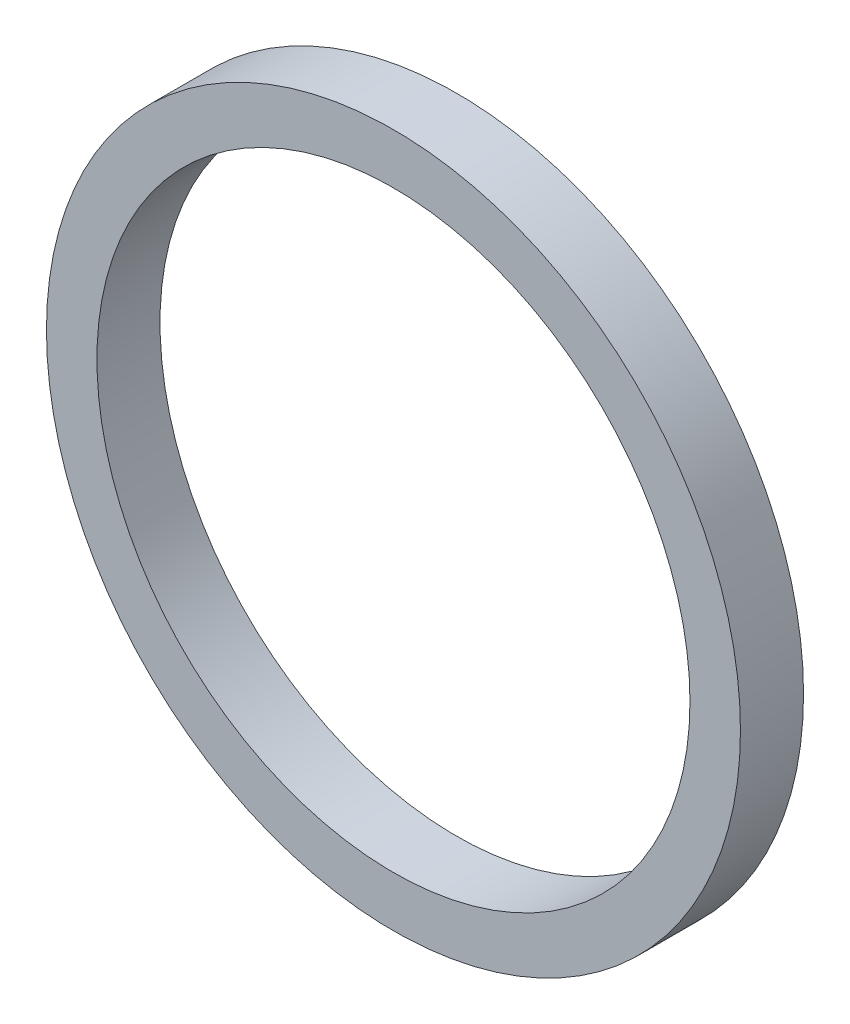
from build123d import *

# Parameters (mm, degrees)
SKETCH1_R           = 16.5
SKETCH1_R_2         = 14.1
BOSS_EXTRUDE1_DEPTH = 3


with BuildPart() as part:
    # Sketch1 → Boss-Extrude1 (new body)
    with BuildSketch(Plane.XY):
        Circle(SKETCH1_R)
        Circle(SKETCH1_R_2, mode=Mode.SUBTRACT)
    extrude(amount=BOSS_EXTRUDE1_DEPTH)


solid = part.part
